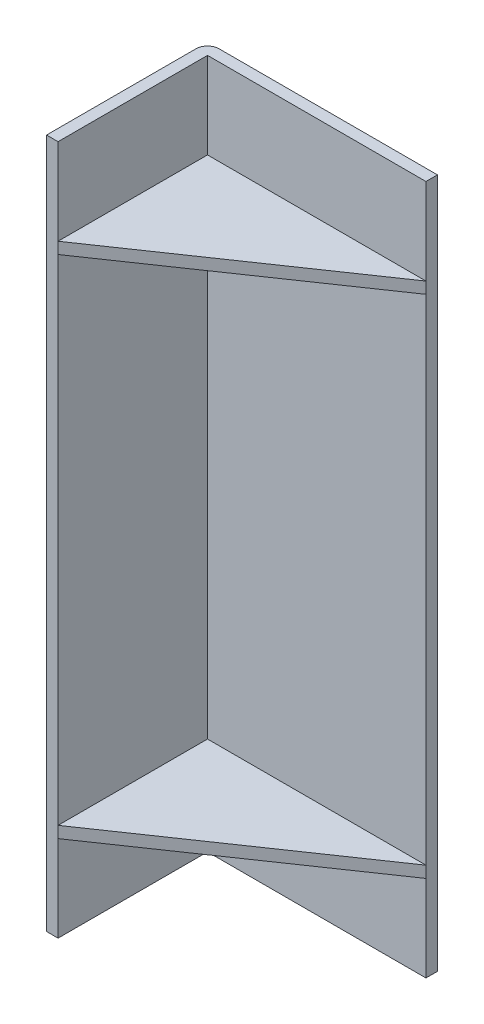
from build123d import *

# Parameters (mm, degrees)
SALIENTE_EXTRUIR1_DEPTH = 150
NERVIO1_REACH           = 289.228
CROQUIS2_WALL_W         = 691.564908986
CROQUIS2_WALL_H         = 5


with BuildPart() as part:
    # Croquis1 → Saliente-Extruir1 (new, symmetric)
    with BuildSketch(Plane(origin=(0, 0, 0), x_dir=(1, 0, 0), z_dir=(0, 1, 0))):
        with BuildLine():
            Line((5, 0), (100, 0))
            Line((100, 0), (100, -5))
            Line((100, -5), (5, -5))
            Line((5, -5), (5, -70))
            Line((5, -70), (0, -70))
            Line((0, -70), (0, -5))
            ThreePointArc((0, -5), (1.464466094, -1.464466094), (5, 0))
        make_face()
    extrude(amount=SALIENTE_EXTRUIR1_DEPTH, both=True)

    # Croquis2 wall → Nervio1 (add, up to next)
    with BuildSketch(Plane(origin=(52.5, 110, 37.5), x_dir=(-0.82530726125, 0, 0.564683915592), z_dir=(0.564683915592, 0, 0.82530726125)), mode=Mode.PRIVATE) as nervio1_sk1:
        Rectangle(CROQUIS2_WALL_W, CROQUIS2_WALL_H)
    nervio1_tool1 = extrude(nervio1_sk1.sketch, amount=-NERVIO1_REACH, mode=Mode.PRIVATE) - part.part
    nervio1 = nervio1_tool1.solids().sort_by_distance((52.5, 110, 37.5))[0]
    add(nervio1)

    # Simetría1: Nervio1 across plane
    add(nervio1.mirror(Plane.ZX))


solid = part.part
